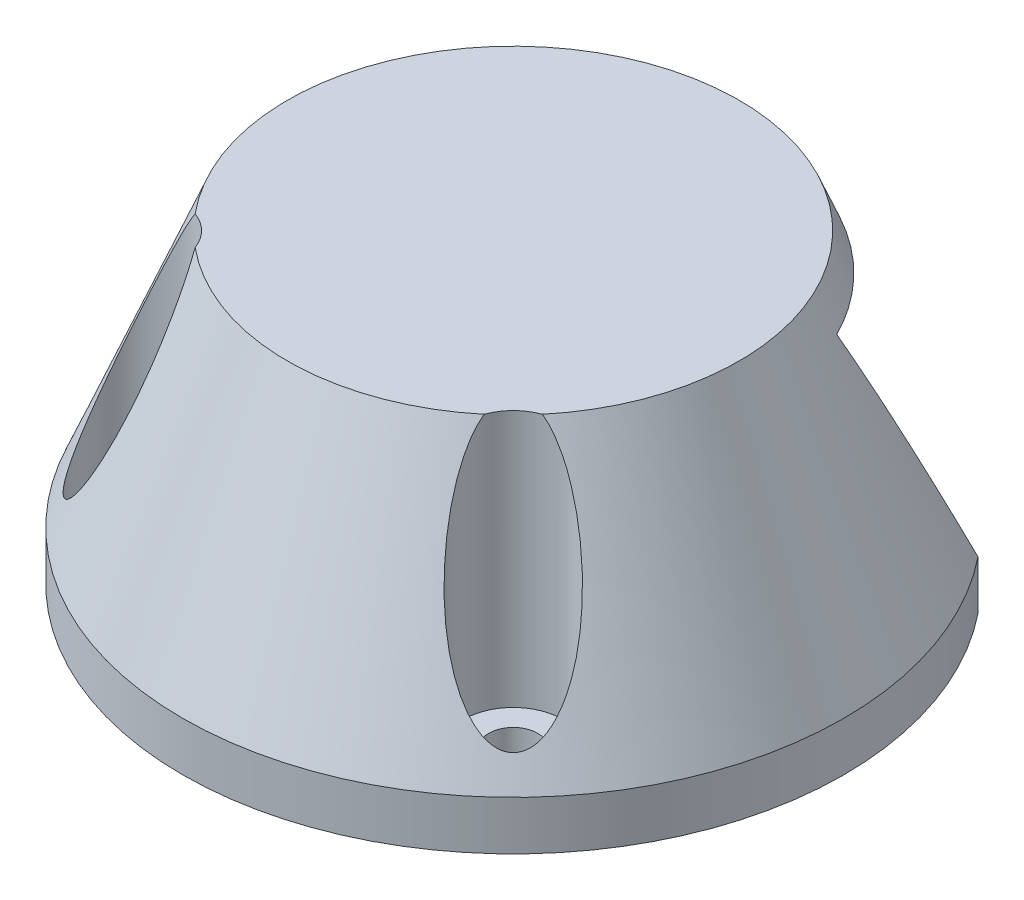
from build123d import *

# Parameters (mm, degrees)
SKETCH5_R          = 2
CUT_EXTRUDE2_DEPTH = 46.639894829
SKETCH6_R          = 4
CUT_EXTRUDE3_DEPTH = 22
SKETCH7_R          = 4.5
CUT_EXTRUDE4_DEPTH = 22
CUT_EXTRUDE5_DEPTH = 22


with BuildPart() as part:
    # Sketch2 → Revolve1 (revolve)
    with BuildSketch(Plane(origin=(0, 0, 0), x_dir=(0, 0, -1), z_dir=(1, 0, 0))):
        Polygon((-18.45, 25), (-27, 4), (-27, 0), (-15, 0), (-15, 22), (0, 22), (0, 25), align=None)
    revolve(axis=Axis((0, 0, 0), (0, 1, 0)))

    # Sketch5 → Cut-Extrude2 (cut, through all)
    with BuildSketch(Plane(origin=(0, 25, 0), x_dir=(1, 0, 0), z_dir=(0, 1, 0))):
        with Locations((-15.556349186, -15.556349186)):
            Circle(SKETCH5_R)
        with Locations((15.556349186, -15.556349186)):
            Circle(SKETCH5_R)
    extrude(amount=-CUT_EXTRUDE2_DEPTH, mode=Mode.SUBTRACT)

    # Sketch6 → Cut-Extrude3 (cut)
    with BuildSketch(Plane(origin=(0, 4, 0), x_dir=(-1, 0, 0), z_dir=(0, -1, 0))):
        with Locations((15.556349186, -15.556349186)):
            Circle(SKETCH6_R)
        with Locations((-15.556349186, -15.556349186)):
            Circle(SKETCH6_R)
    extrude(amount=-CUT_EXTRUDE3_DEPTH, mode=Mode.SUBTRACT)

    # Sketch7 → Cut-Extrude4 (cut)
    with BuildSketch(Plane(origin=(0, 0, 0), x_dir=(-1, 0, 0), z_dir=(0, -1, 0))):
        with Locations((15.556349186, 15.556349186)):
            Circle(SKETCH7_R)
        with Locations((-15.556349186, 15.556349186)):
            Circle(SKETCH7_R)
    extrude(amount=-CUT_EXTRUDE4_DEPTH, mode=Mode.SUBTRACT)

    # Sketch10 → Cut-Extrude5 (cut)
    with BuildSketch(Plane.XZ):
        with BuildLine():
            Line((-14.704067619, 2.964860106), (-16.680641023, -6.837851641))
            Line((-16.680641023, -6.837851641), (-21.048400418, -16.910494961))
            ThreePointArc((-21.048400418, -16.910494961), (-18.731046773, -19.446024961), (-16.110526631, -21.666816371))
            ThreePointArc((-16.110526631, -21.666816371), (0, -27), (16.110526631, -21.666816371))
            ThreePointArc((16.110526631, -21.666816371), (18.731046773, -19.446024961), (21.048400418, -16.910494961))
            Line((21.048400418, -16.910494961), (16.680641023, -6.837851641))
            Line((16.680641023, -6.837851641), (14.704067619, 2.964860106))
            ThreePointArc((14.704067619, 2.964860106), (0, 15), (-14.704067619, 2.964860106))
        make_face()
    extrude(amount=-CUT_EXTRUDE5_DEPTH, mode=Mode.SUBTRACT)


solid = part.part
